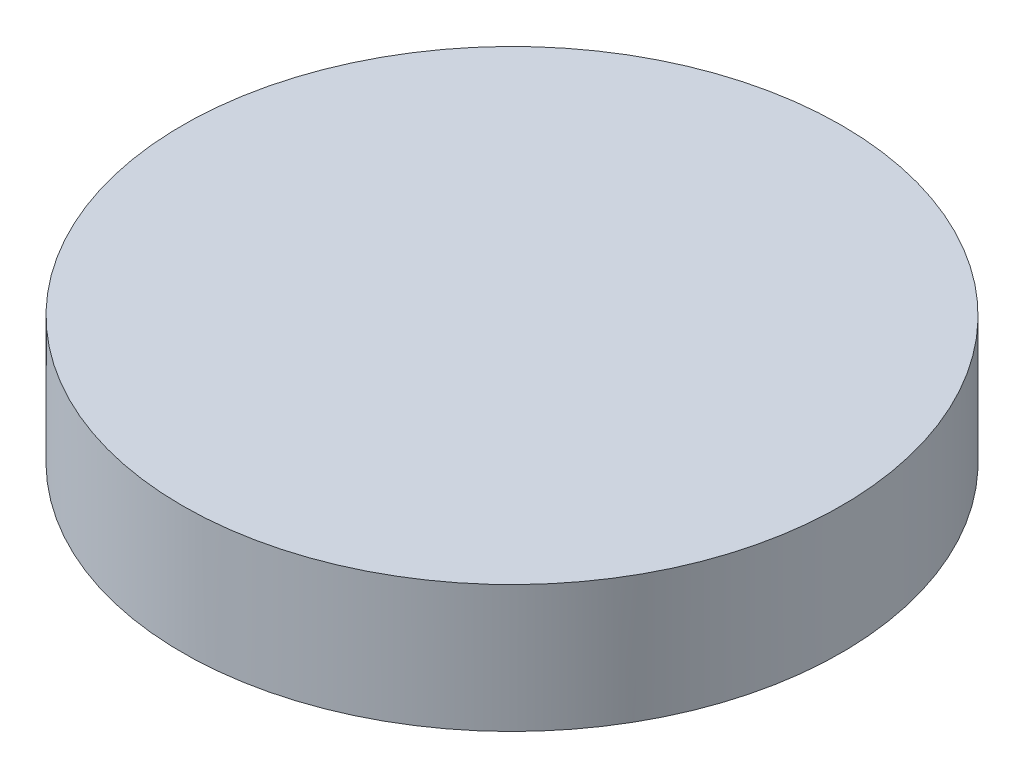
from build123d import *

# Parameters (mm, degrees)
SKETCH1_R           = 31
BOSS_EXTRUDE1_DEPTH = 7.5
BOSS_EXTRUDE2_START = 4.47
SKETCH3_R           = 31
SKETCH3_R_2         = 27.13
BOSS_EXTRUDE2_DEPTH = 4.47


with BuildPart() as part:
    # Sketch1 → Boss-Extrude1 (new body)
    with BuildSketch(Plane(origin=(0, 0, 0), x_dir=(1, 0, 0), z_dir=(0, 1, 0))):
        with Locations(Location((0, 0, 0), (0, 0, 270))):
            Circle(SKETCH1_R)
    extrude(amount=BOSS_EXTRUDE1_DEPTH)

    # Sketch3 → Boss-Extrude2 (add)
    with BuildSketch(Plane.XZ.offset(BOSS_EXTRUDE2_START)):
        with Locations(Location((0, 0, 0), (0, 0, 270))):
            Circle(SKETCH3_R)
        with Locations(Location((0, 0, 0), (0, 0, 270))):
            Circle(SKETCH3_R_2, mode=Mode.SUBTRACT)
    extrude(amount=-BOSS_EXTRUDE2_DEPTH)


solid = part.part
